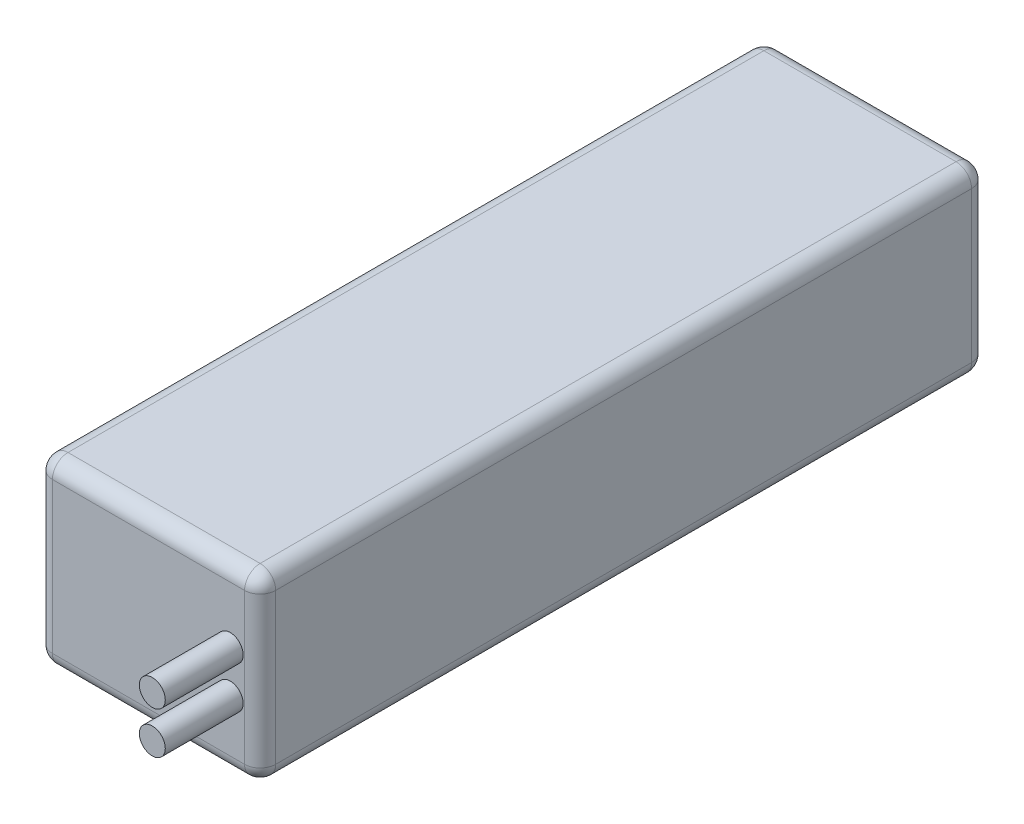
from build123d import *

# Parameters (mm, degrees)
SKETCH_1_W      = 43
SKETCH_1_H      = 35
EXTRUDE_1_DEPTH = 140
SKETCH_2_R      = 2.5
EXTRUDE_2_DEPTH = 15
FILLET_1_R      = 3


with BuildPart() as part:
    # Эскиз1 → Бобышка-Вытянуть1 (new body)
    with BuildSketch(Plane.XY):
        Rectangle(SKETCH_1_W, SKETCH_1_H)
    extrude(amount=EXTRUDE_1_DEPTH)

    # Эскиз2 → Бобышка-Вытянуть2 (add)
    with BuildSketch(Plane.XY.offset(140)):
        with Locations((15.734743007, 3.598639962)):
            Circle(SKETCH_2_R)
        with Locations((15.734743007, -4.492095401)):
            Circle(SKETCH_2_R)
    extrude(amount=EXTRUDE_2_DEPTH)

    # Скругление1
    fillet_1_edges = [part.edges().sort_by_distance(p)[0] for p in [
        (-21.5, 0, 140),
        (0, -17.5, 140),
        (21.5, 0, 140),
        (0, -17.5, 0),
        (-21.5, 0, 0),
        (0, 17.5, 0),
        (21.5, 0, 0),
        (0, 17.5, 140),
        (21.5, -17.5, 70),
        (-21.5, -17.5, 70),
        (-21.5, 17.5, 70),
        (21.5, 17.5, 70),
    ]]
    fillet(fillet_1_edges, radius=FILLET_1_R)


solid = part.part
